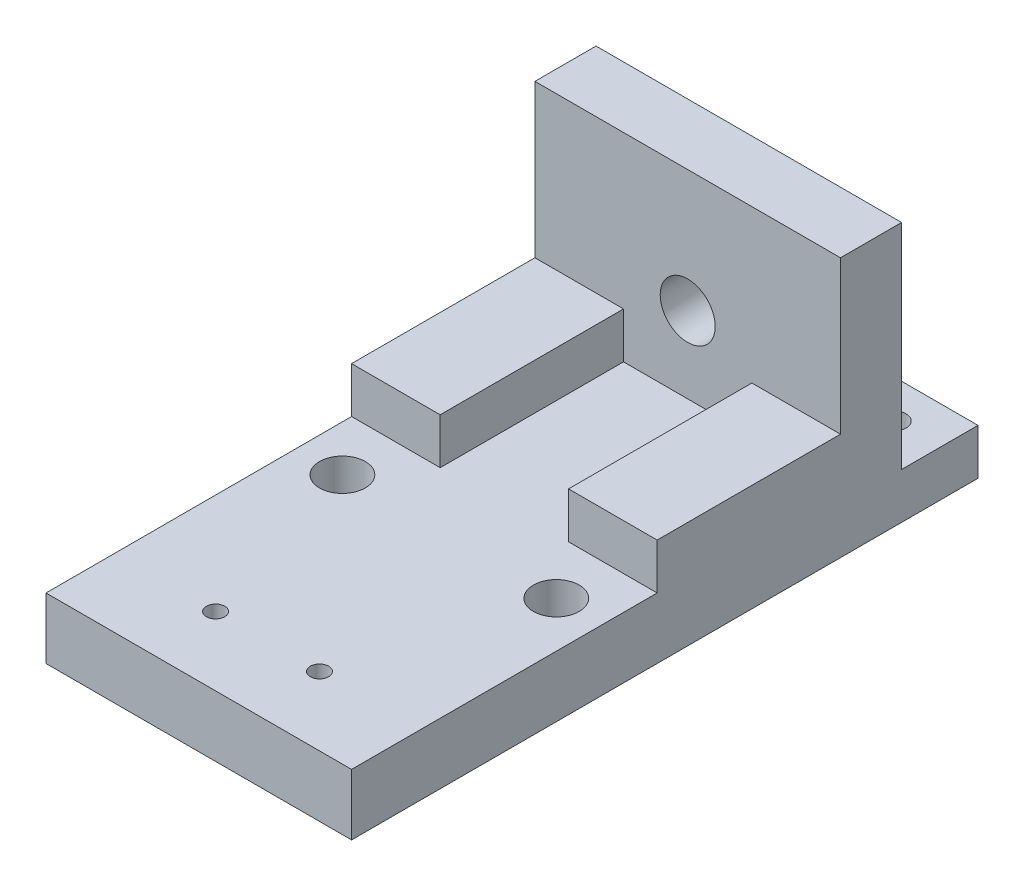
from build123d import *

# Parameters (mm, degrees)
Y_KSEKLIK_EKSTR_ZYON1_DEPTH = 100
IZIM2_W                     = 42
IZIM2_H                     = 60
KES_EKSTR_ZYON1_DEPTH       = 15
IZIM3_R                     = 4
IZIM3_R_2                   = 3
KES_EKSTR_ZYON2_DEPTH       = 175.685863047
IZIM4_R                     = 7.5
KES_EKSTR_ZYON5_DEPTH       = 175.685863047
IZIM5_R                     = 9
KES_EKSTR_ZYON6_DEPTH       = 226.427594277


with BuildPart() as part:
    # Çizim1 → Yükseklik-Ekstrüzyon1 (new body)
    with BuildSketch(Plane(origin=(0, 0, 0), x_dir=(0, 0, -1), z_dir=(1, 0, 0))):
        Polygon((-127.632874873, 26.747480954), (-127.632874873, 6.747480954), (77.367125127, 6.747480954), (77.367125127, 21.747480954), (52.367125127, 21.747480954), (52.367125127, 91.747480954), (32.367125127, 91.747480954), (32.367125127, 41.747480954), (-27.632874873, 41.747480954), (-27.632874873, 26.747480954), align=None)
    extrude(amount=Y_KSEKLIK_EKSTR_ZYON1_DEPTH)

    # Çizim2 → Kes-Ekstrüzyon1 (cut)
    with BuildSketch(Plane(origin=(0, 41.747480954, 0), x_dir=(1, 0, 0), z_dir=(0, 1, 0))):
        with Locations((50, 2.367125127)):
            Rectangle(IZIM2_W, IZIM2_H)
    extrude(amount=-KES_EKSTR_ZYON1_DEPTH, mode=Mode.SUBTRACT)

    # Çizim3 → Kes-Ekstrüzyon2 (cut, through all)
    with BuildSketch(Plane(origin=(0, 26.747480954, 0), x_dir=(1, 0, 0), z_dir=(0, 1, 0))):
        with Locations(Location((15, 64.867125127, 0), (0, 0, 270))):
            Circle(IZIM3_R)
        with Locations(Location((85, 64.867125127, 0), (0, 0, 270))):
            Circle(IZIM3_R)
        with Locations(Location((33, -105.132874873, 0), (0, 0, 270))):
            Circle(IZIM3_R_2)
        with Locations(Location((67, -105.132874873, 0), (0, 0, 270))):
            Circle(IZIM3_R_2)
    extrude(amount=-KES_EKSTR_ZYON2_DEPTH, mode=Mode.SUBTRACT)

    # Çizim4 → Kes-Ekstrüzyon5 (cut, through all)
    with BuildSketch(Plane(origin=(0, 26.747480954, 0), x_dir=(1, 0, 0), z_dir=(0, 1, 0))):
        with Locations(Location((15, -45.632874873, 0), (0, 0, 270))):
            Circle(IZIM4_R)
        with Locations(Location((85, -45.632874873, 0), (0, 0, 270))):
            Circle(IZIM4_R)
    extrude(amount=-KES_EKSTR_ZYON5_DEPTH, mode=Mode.SUBTRACT)

    # Çizim5 → Kes-Ekstrüzyon6 (cut, through all)
    with BuildSketch(Plane(origin=(0, 0, -52.367125127), x_dir=(-1, 0, 0), z_dir=(0, 0, -1))):
        with Locations((-50, 51.747480954)):
            Circle(IZIM5_R)
    extrude(amount=-KES_EKSTR_ZYON6_DEPTH, mode=Mode.SUBTRACT)


solid = part.part
